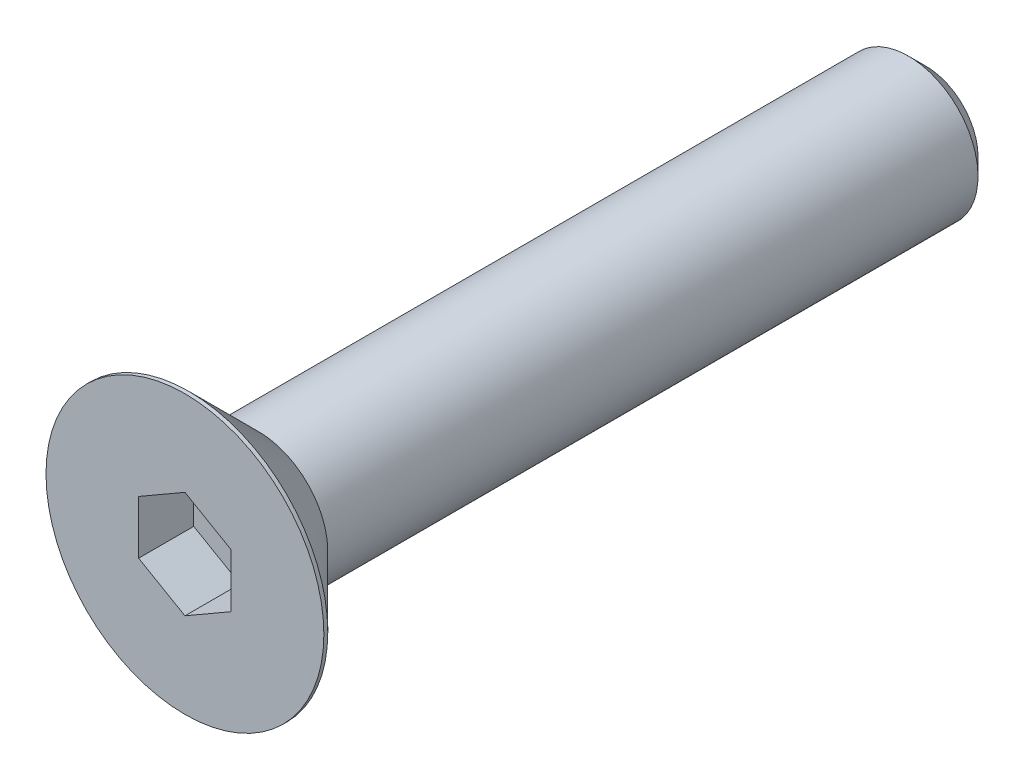
from build123d import *

# Parameters (mm, degrees)
CHAMFER1_SIZE      = 0.375
CUT_EXTRUDE2_DEPTH = 1.19


with BuildPart() as part:
    # Sketch1 → Revolve1 (revolve)
    with BuildSketch(Plane(origin=(0, 0, 0), x_dir=(0, 0, -1), z_dir=(1, 0, 0))):
        Polygon((-6.3, 1.5), (8, 1.5), (8, 0), (-6.81, 0), (-6.81, 1.5), align=None)
    revolve(axis=Axis((0, 0, 6.81), (0, 0, -1)))

    # Chamfer1
    chamfer1_edges = [part.edges().sort_by_distance(p)[0] for p in [
        (0, -1.5, -8),
    ]]
    chamfer(chamfer1_edges, length=CHAMFER1_SIZE)


with BuildPart() as body_2:
    # Sketch7 → Revolve2 (revolve)
    with BuildSketch(Plane(origin=(0, 0, 0), x_dir=(0, 0, -1), z_dir=(1, 0, 0))):
        Polygon((-7.915, 3), (-8, 3), (-8, 0), (-6.3, 0), (-6.3, 1.385), align=None)
    revolve(axis=Axis((0, 0, 8), (0, 0, -1)))

    # Sketch5 → Cut-Extrude2 (cut)
    with BuildSketch(Plane.XY.offset(8)):
        Polygon((1, -0.577350269), (1, 0.577350269), (0, 1.154700538), (-1, 0.577350269), (-1, -0.577350269), (0, -1.154700538), align=None)
    extrude(amount=-CUT_EXTRUDE2_DEPTH, mode=Mode.SUBTRACT)


solid = Compound([part.part, body_2.part])
